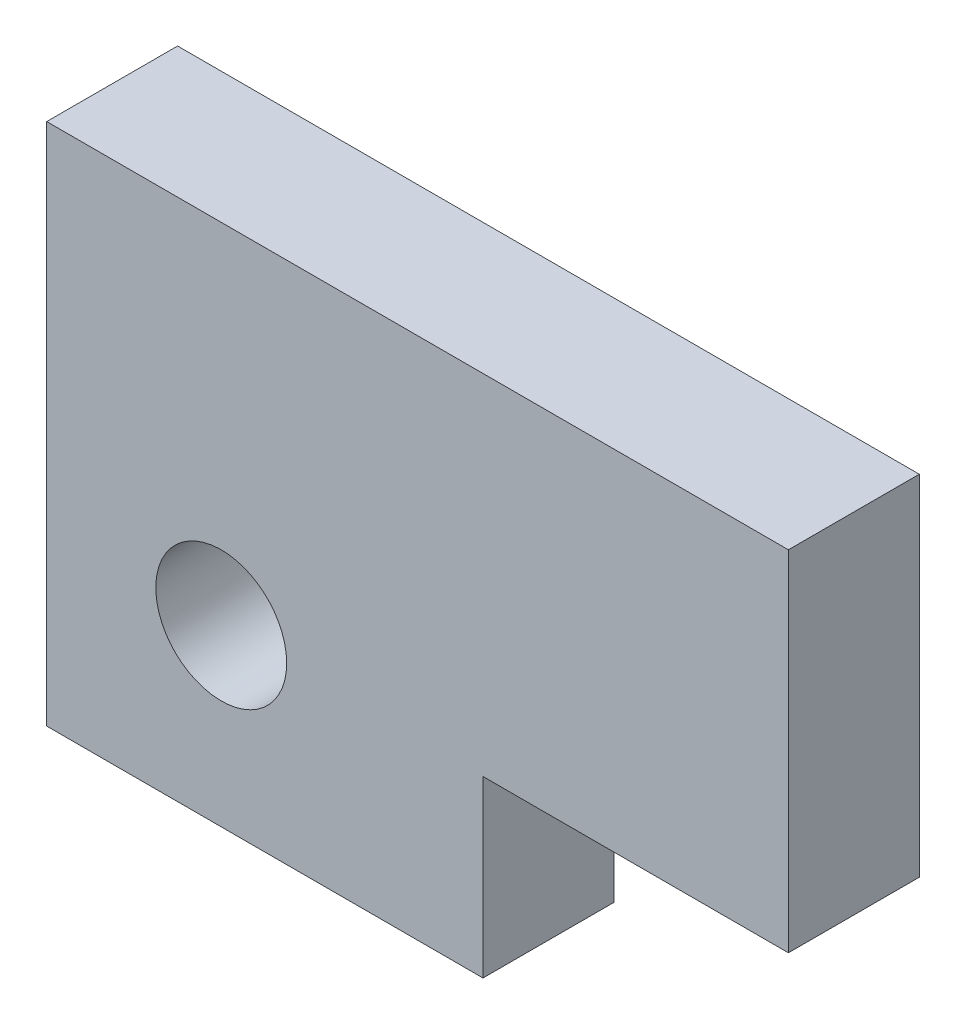
from build123d import *

# Parameters (mm, degrees)
EXTRUDE_1_DEPTH     = 3
SKETCH_2_R          = 1.5
CUT_EXTRUDE_1_DEPTH = 22.023796042


with BuildPart() as part:
    # Эскиз1 → Бобышка-Вытянуть1 (new body)
    with BuildSketch(Plane.XY):
        Polygon((0, 0), (10, 0), (10, 4), (17, 4), (17, 12), (0, 12), align=None)
    extrude(amount=EXTRUDE_1_DEPTH)

    # Эскиз2 → Вырез-Вытянуть1 (cut, through all)
    with BuildSketch(Plane.XY.offset(3)):
        with Locations((4, 4)):
            Circle(SKETCH_2_R)
    extrude(amount=-CUT_EXTRUDE_1_DEPTH, mode=Mode.SUBTRACT)


solid = part.part
